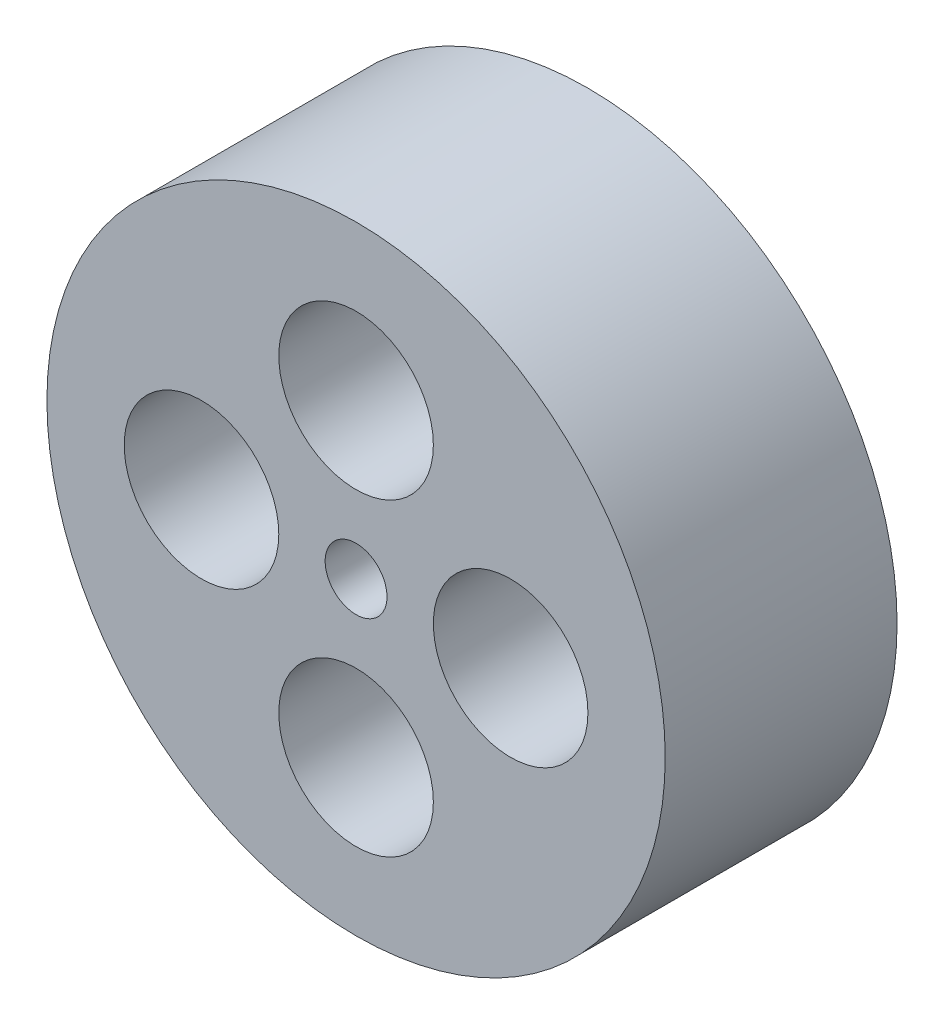
from build123d import *

# Parameters (mm, degrees)
SKETCH1_R           = 40
SKETCH1_R_2         = 4
SKETCH1_R_3         = 10
BOSS_EXTRUDE1_DEPTH = 30


with BuildPart() as part:
    # Sketch1 → Boss-Extrude1 (new body)
    with BuildSketch(Plane.XY):
        Circle(SKETCH1_R)
        Circle(SKETCH1_R_2, mode=Mode.SUBTRACT)
        with Locations((0, 20)):
            Circle(SKETCH1_R_3, mode=Mode.SUBTRACT)
        with Locations((20, 0)):
            Circle(SKETCH1_R_3, mode=Mode.SUBTRACT)
        with Locations((0, -20)):
            Circle(SKETCH1_R_3, mode=Mode.SUBTRACT)
        with Locations((-20, 0)):
            Circle(SKETCH1_R_3, mode=Mode.SUBTRACT)
    extrude(amount=BOSS_EXTRUDE1_DEPTH)


solid = part.part
